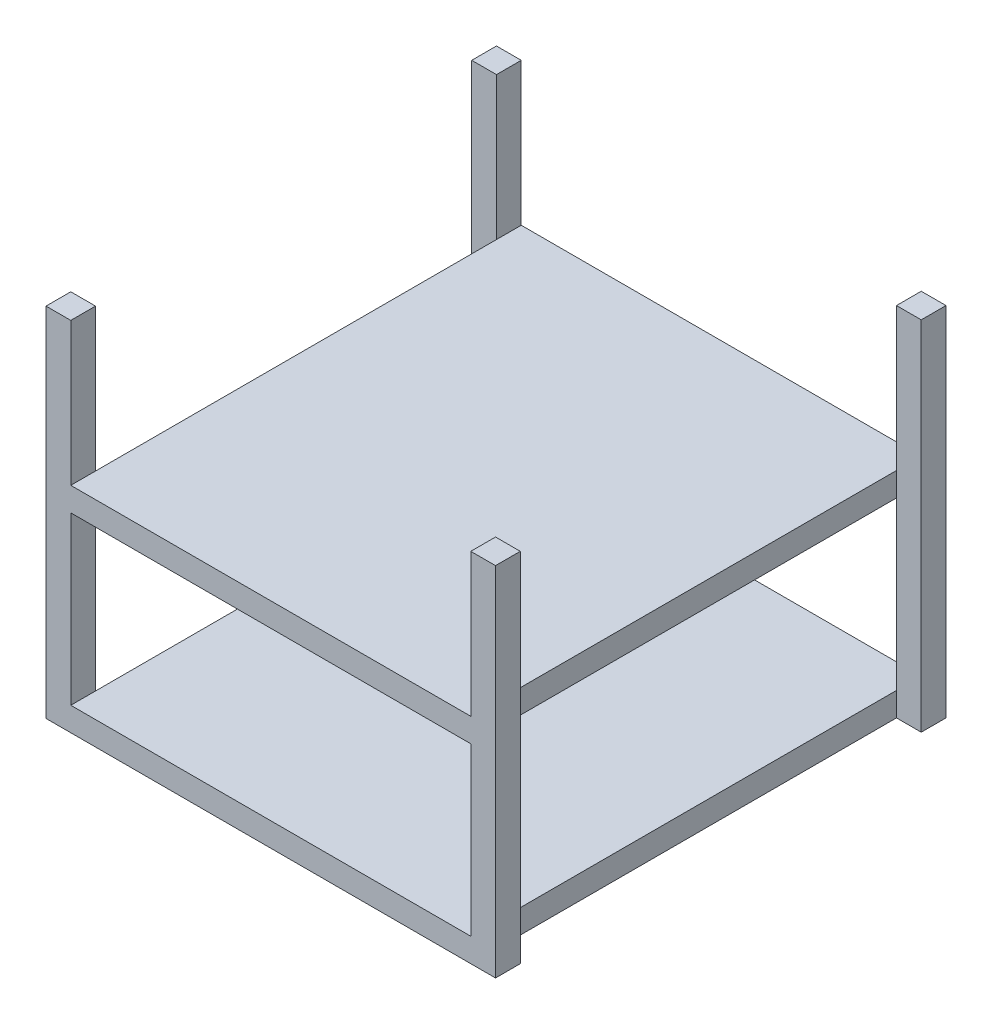
from build123d import *

# Parameters (mm, degrees)
SKETCH1_W           = 13.208
SKETCH1_H           = 13.208
BOSS_EXTRUDE1_DEPTH = 190.5
SKETCH3_W           = 213.36
SKETCH3_H           = 88.9
SKETCH3_H_2         = 76.2
CUT_EXTRUDE2_DEPTH  = 304.8


with BuildPart() as part:
    # Sketch1 → Boss-Extrude1 (new body)
    with BuildSketch(Plane(origin=(0, 0, 0), x_dir=(1, 0, 0), z_dir=(0, 1, 0))):
        Polygon((106.68, 120.142), (0, 120.142), (0, 0), (106.68, 0), (106.68, 106.934), align=None)
        with Locations((113.284, 113.538)):
            Rectangle(SKETCH1_W, SKETCH1_H)
        Polygon((106.68, 0), (0, 0), (0, -120.142), (106.68, -120.142), (106.68, -106.934), align=None)
        Polygon((0, -120.142), (0, 0), (-106.68, 0), (-106.68, -106.934), (-106.68, -120.142), align=None)
        with Locations((-113.284, -113.538)):
            Rectangle(SKETCH1_W, SKETCH1_H)
        Polygon((0, 0), (0, 120.142), (-106.68, 120.142), (-106.68, 106.934), (-106.68, 0), align=None)
        with Locations((-113.284, 113.538)):
            Rectangle(SKETCH1_W, SKETCH1_H)
        with Locations((113.284, -113.538)):
            Rectangle(SKETCH1_W, SKETCH1_H)
    extrude(amount=BOSS_EXTRUDE1_DEPTH)

    # Sketch3 → Cut-Extrude2 (cut)
    with BuildSketch(Plane.XY.offset(120.142)):
        with Locations((0, 57.15)):
            Rectangle(SKETCH3_W, SKETCH3_H)
        with Locations((0, 152.4)):
            Rectangle(SKETCH3_W, SKETCH3_H_2)
    extrude(amount=-CUT_EXTRUDE2_DEPTH, mode=Mode.SUBTRACT)


solid = part.part
